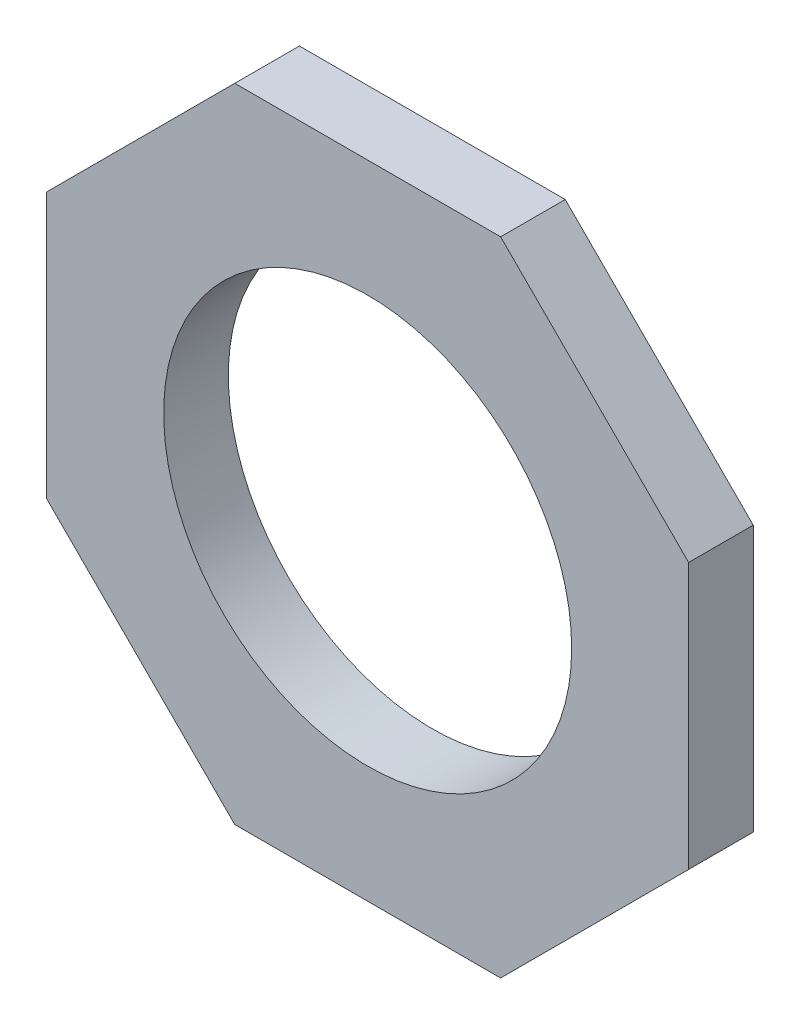
from build123d import *

# Parameters (mm, degrees)
SKETCH1_R           = 5.05
BOSS_EXTRUDE1_DEPTH = 1.6


with BuildPart() as part:
    # Sketch1 → Boss-Extrude1 (new body)
    with BuildSketch(Plane.XY):
        Polygon((-3.291077518, 7.94536398), (3.291077518, 7.94536398), (7.94536398, 3.291077518), (7.94536398, -3.291077518), (3.291077518, -7.94536398), (-3.291077518, -7.94536398), (-7.94536398, -3.291077518), (-7.94536398, 3.291077518), align=None)
        Circle(SKETCH1_R, mode=Mode.SUBTRACT)
    extrude(amount=BOSS_EXTRUDE1_DEPTH)


solid = part.part
